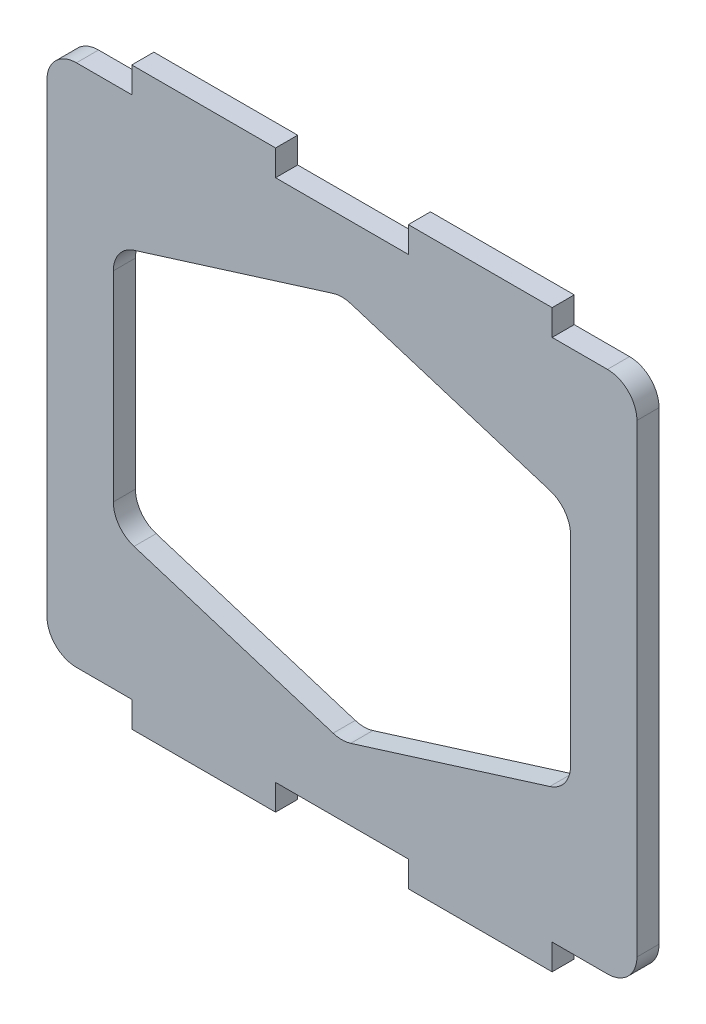
from build123d import *

# Parameters (mm, degrees)
SALIENTE_EXTRUIR1_DEPTH = 1.5


with BuildPart() as part:
    # Croquis1 → Saliente-Extruir1 (new body)
    with BuildSketch(Plane(origin=(0, 0, 0), x_dir=(-1, 0, 0), z_dir=(0, 0, -1))):
        with BuildLine():
            Line((18, 17.75), (14.25, 17.75))
            Line((14.25, 17.75), (14.25, 19.5))
            Line((14.25, 19.5), (4.5, 19.5))
            Line((4.5, 19.5), (4.5, 17.75))
            Line((4.5, 17.75), (-4.5, 17.75))
            Line((-4.5, 17.75), (-4.5, 19.5))
            Line((-4.5, 19.5), (-14.25, 19.5))
            Line((-14.25, 19.5), (-14.25, 17.75))
            Line((-14.25, 17.75), (-18, 17.75))
            ThreePointArc((-18, 17.75), (-19.414213562, 17.164213562), (-20, 15.75))
            Line((-20, 15.75), (-20, -15.75))
            ThreePointArc((-20, -15.75), (-19.414213562, -17.164213562), (-18, -17.75))
            Line((-18, -17.75), (-14.25, -17.75))
            Line((-14.25, -17.75), (-14.25, -19.5))
            Line((-14.25, -19.5), (-4.5, -19.5))
            Line((-4.5, -19.5), (-4.5, -17.75))
            Line((-4.5, -17.75), (4.5, -17.75))
            Line((4.5, -17.75), (4.5, -19.5))
            Line((4.5, -19.5), (14.25, -19.5))
            Line((14.25, -19.5), (14.25, -17.75))
            Line((14.25, -17.75), (18, -17.75))
            ThreePointArc((18, -17.75), (19.414213562, -17.164213562), (20, -15.75))
            Line((20, -15.75), (20, 15.75))
            ThreePointArc((20, 15.75), (19.414213562, 17.164213562), (18, 17.75))
        make_face()
        with BuildLine():
            Line((-0.596130775, -12.909090909), (-14.096130775, -8.693594715))
            ThreePointArc((-14.096130775, -8.693594715), (-15.111251307, -7.96935368), (-15.5, -6.784503806))
            Line((-15.5, -6.784503806), (-15.5, 6.784503806))
            ThreePointArc((-15.5, 6.784503806), (-15.111251307, 7.96935368), (-14.096130775, 8.693594715))
            Line((-14.096130775, 8.693594715), (-0.596130775, 12.909090909))
            ThreePointArc((-0.596130775, 12.909090909), (0, 13), (0.596130775, 12.909090909))
            Line((0.596130775, 12.909090909), (14.096130775, 8.693594715))
            ThreePointArc((14.096130775, 8.693594715), (15.111251307, 7.96935368), (15.5, 6.784503806))
            Line((15.5, 6.784503806), (15.5, -6.784503806))
            ThreePointArc((15.5, -6.784503806), (15.111251307, -7.96935368), (14.096130775, -8.693594715))
            Line((14.096130775, -8.693594715), (0.596130775, -12.909090909))
            ThreePointArc((0.596130775, -12.909090909), (0, -13), (-0.596130775, -12.909090909))
        make_face(mode=Mode.SUBTRACT)
    extrude(amount=-SALIENTE_EXTRUIR1_DEPTH)


solid = part.part
